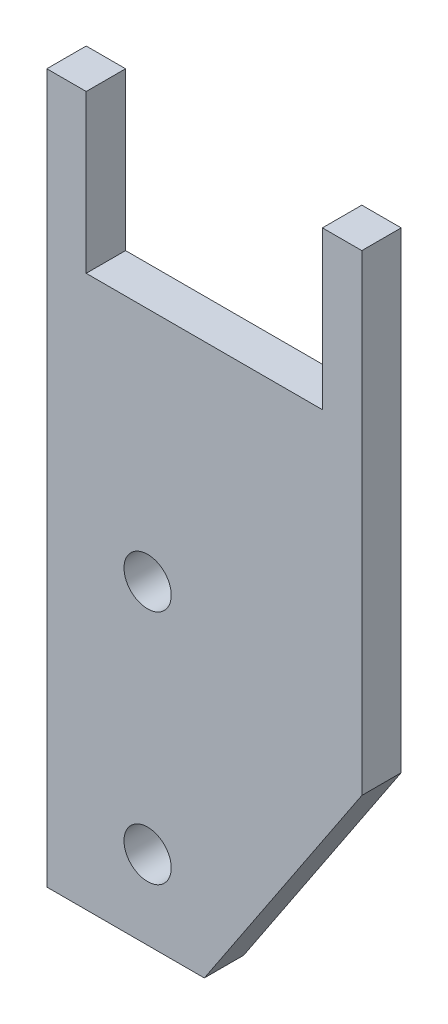
from build123d import *

# Parameters (mm, degrees)
SKETCH1_R           = 3.81
BOSS_EXTRUDE1_DEPTH = 6.35


with BuildPart() as part:
    # Sketch1 → Boss-Extrude1 (new body)
    with BuildSketch(Plane.XY):
        Polygon((0, 0), (0, 25.4), (-6.35, 25.4), (-6.35, -88.9), (19.05, -88.9), (44.45, -50.703630574), (44.45, 0.096369426), (44.45, 25.4), (38.1, 25.4), (38.1, 0), align=None)
        with Locations((9.906, -38.1)):
            Circle(SKETCH1_R, mode=Mode.SUBTRACT)
        with Locations((9.906, -76.2)):
            Circle(SKETCH1_R, mode=Mode.SUBTRACT)
    extrude(amount=BOSS_EXTRUDE1_DEPTH)


solid = part.part
